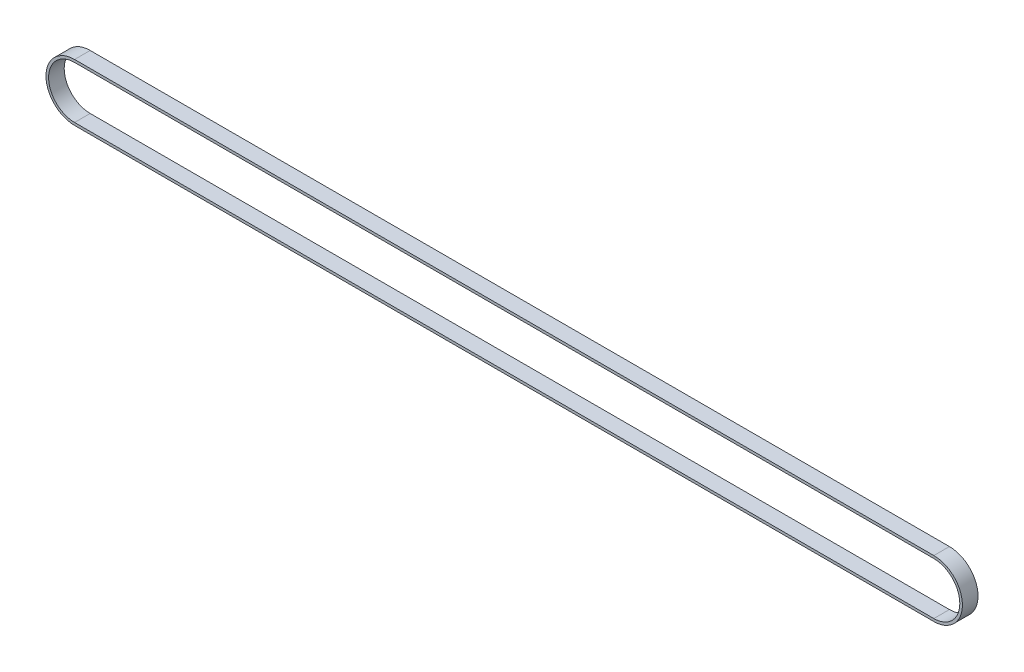
from build123d import *

# Parameters (mm, degrees)
BOSS_EXTRUDE1_DEPTH = 6


with BuildPart() as part:
    # Sketch1 → Boss-Extrude1 (new body)
    with BuildSketch(Plane.XY):
        with BuildLine():
            Line((0, 11), (330.7, 11))
            ThreePointArc((330.7, 11), (341.7, 0), (330.7, -11))
            Line((330.7, -11), (0, -11))
            ThreePointArc((0, -11), (-11, 0), (0, 11))
        make_face()
        with BuildLine():
            Line((0, 10), (330.7, 10))
            ThreePointArc((330.7, 10), (340.7, 0), (330.7, -10))
            Line((330.7, -10), (0, -10))
            ThreePointArc((0, -10), (-10, 0), (0, 10))
        make_face(mode=Mode.SUBTRACT)
    extrude(amount=BOSS_EXTRUDE1_DEPTH)


solid = part.part
